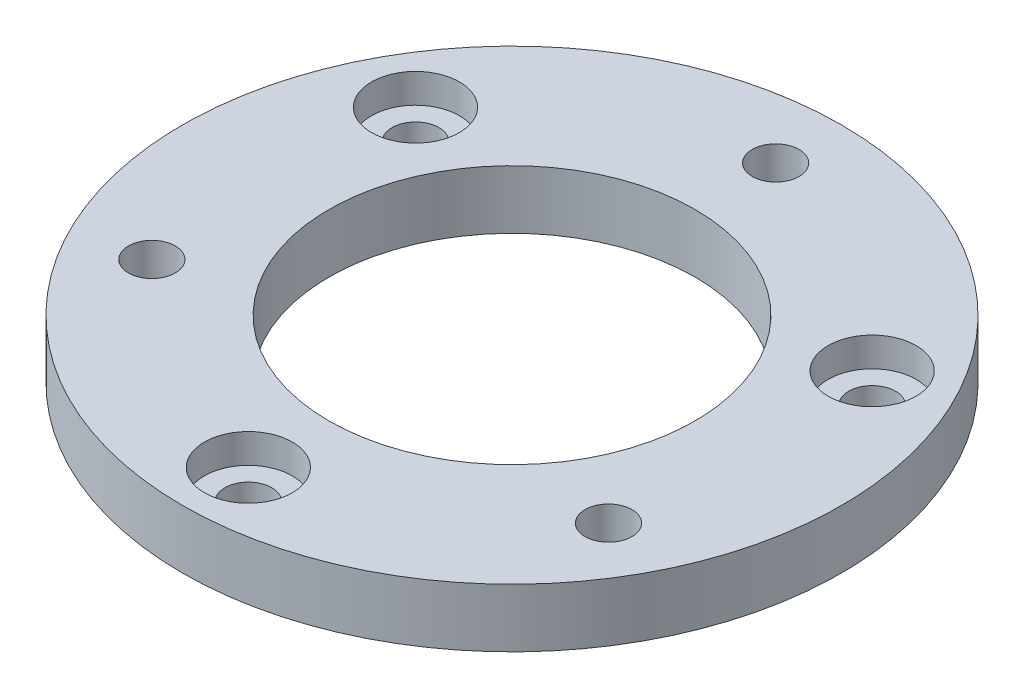
from build123d import *

# Parameters (mm, degrees)
SKETCH1_R           = 22.5
SKETCH1_R_2         = 1.6
SKETCH1_R_3         = 12.5
BOSS_EXTRUDE1_DEPTH = 4
SKETCH2_R           = 3
CUT_EXTRUDE1_DEPTH  = 2


with BuildPart() as part:
    # Sketch1 → Boss-Extrude1 (new body)
    with BuildSketch(Plane(origin=(0, 0, 0), x_dir=(1, 0, 0), z_dir=(0, 1, 0))):
        with Locations(Location((0, 0, 0), (0, 0, 270))):
            Circle(SKETCH1_R)
        with Locations(Location((0, 18, 0), (0, 0, 270))):
            Circle(SKETCH1_R_2, mode=Mode.SUBTRACT)
        with Locations(Location((15.588457268, 9, 0), (0, 0, 270))):
            Circle(SKETCH1_R_2, mode=Mode.SUBTRACT)
        with Locations(Location((15.588457268, -9, 0), (0, 0, 270))):
            Circle(SKETCH1_R_2, mode=Mode.SUBTRACT)
        with Locations(Location((0, -18, 0), (0, 0, 270))):
            Circle(SKETCH1_R_2, mode=Mode.SUBTRACT)
        with Locations(Location((-15.588457268, -9, 0), (0, 0, 270))):
            Circle(SKETCH1_R_2, mode=Mode.SUBTRACT)
        with Locations(Location((-15.588457268, 9, 0), (0, 0, 270))):
            Circle(SKETCH1_R_2, mode=Mode.SUBTRACT)
        with Locations(Location((0, 0, 0), (0, 0, 270))):
            Circle(SKETCH1_R_3, mode=Mode.SUBTRACT)
    extrude(amount=BOSS_EXTRUDE1_DEPTH)

    # Sketch2 → Cut-Extrude1 (cut)
    with BuildSketch(Plane(origin=(0, 4, 0), x_dir=(1, 0, 0), z_dir=(0, 1, 0))):
        with Locations(Location((-15.588457268, 9, 0), (0, 0, 270))):
            Circle(SKETCH2_R)
        with Locations(Location((15.588457268, 9, 0), (0, 0, 270))):
            Circle(SKETCH2_R)
        with Locations(Location((0, -18, 0), (0, 0, 270))):
            Circle(SKETCH2_R)
    extrude(amount=-CUT_EXTRUDE1_DEPTH, mode=Mode.SUBTRACT)


solid = part.part
